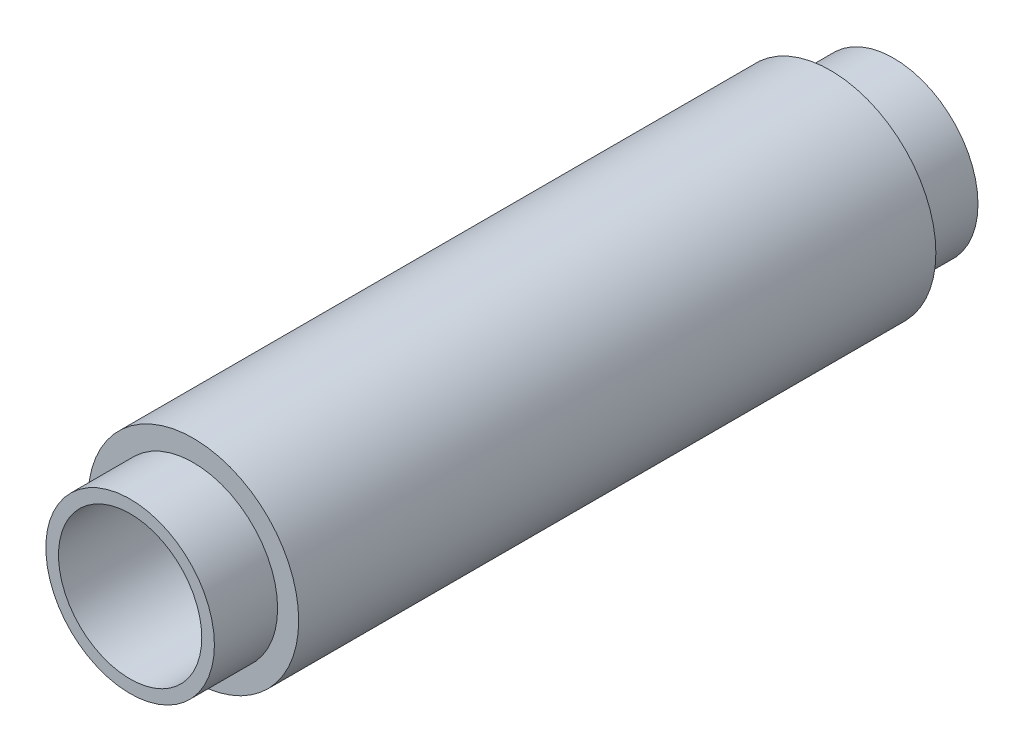
from build123d import *


with BuildPart() as part:
    # Эскиз1 → Повернуть1 (revolve)
    with BuildSketch(Plane(origin=(0, 0, 0), x_dir=(1, 0, 0), z_dir=(0, 1, 0)), mode=Mode.PRIVATE) as revolve_1_sk:
        Polygon((-25, 0), (-17, 0), (-17, -90.6), (-20, -90.6), (-20, -75.6), (-25, -75.6), align=None)
    revolve_1 = revolve(revolve_1_sk.sketch.rotate(Axis((0, 0, 1000), (0, 0, -1)), 180), axis=Axis((0, 0, 1000), (0, 0, -1)))

    # Зеркальное отражение1: Повернуть1 across plane
    add(revolve_1.mirror(Plane(origin=(-25, 0, 0), x_dir=(1, 0, 0), z_dir=(0, 0, 1))))


solid = part.part
